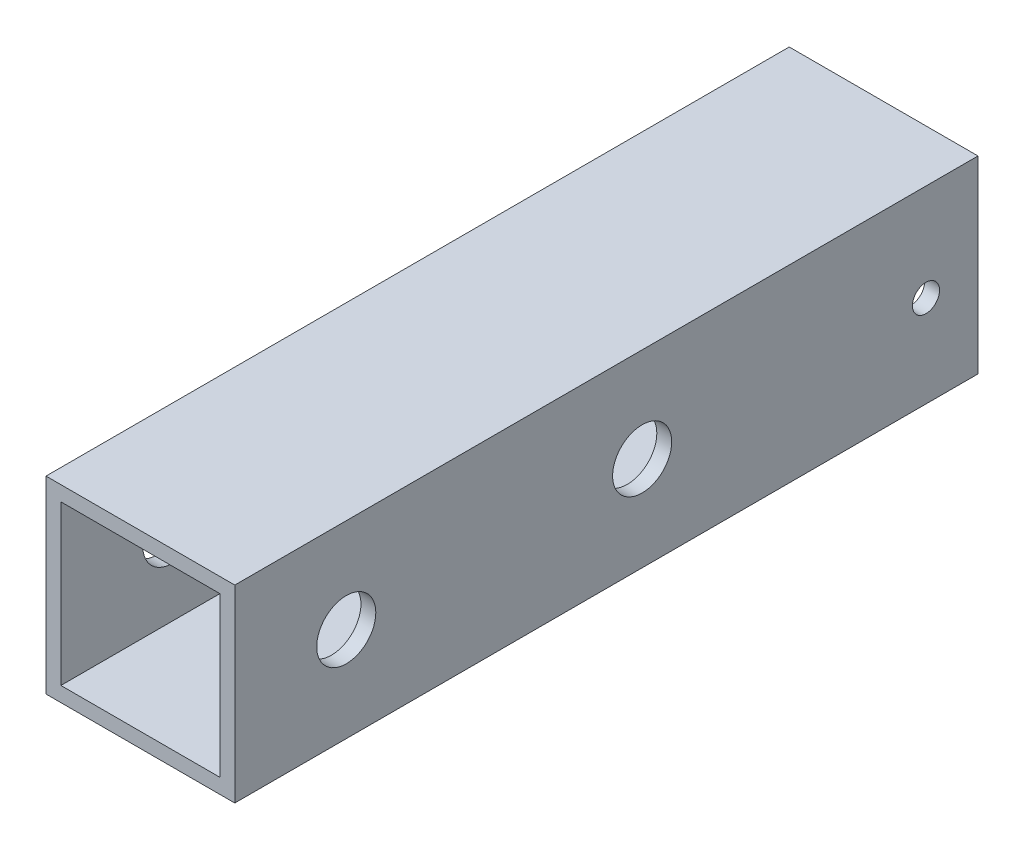
from build123d import *

# Parameters (mm, degrees)
SKETCH1_W           = 25.4
SKETCH1_H           = 25.4
SKETCH1_W_2         = 21.4
SKETCH1_H_2         = 21.4
BOSS_EXTRUDE1_DEPTH = 100
SKETCH2_R           = 3.975
CUT_EXTRUDE1_DEPTH  = 50
SKETCH3_R           = 1.55
CUT_EXTRUDE4_DEPTH  = 10
SKETCH4_R           = 1.778
CUT_EXTRUDE5_DEPTH  = 10
CUT_EXTRUDE6_REACH  = 108.256
SKETCH5_R           = 1.825


with BuildPart() as part:
    # Sketch1 → Boss-Extrude1 (new body)
    with BuildSketch(Plane.XY):
        with Locations((12.7, 12.7)):
            Rectangle(SKETCH1_W, SKETCH1_H)
        with Locations((12.7, 12.7)):
            Rectangle(SKETCH1_W_2, SKETCH1_H_2, mode=Mode.SUBTRACT)
    extrude(amount=BOSS_EXTRUDE1_DEPTH)

    # Sketch2 → Cut-Extrude1 (cut)
    with BuildSketch(Plane(origin=(25.4, 0, 0), x_dir=(0, 0, -1), z_dir=(1, 0, 0))):
        with Locations((-85, 12.7)):
            Circle(SKETCH2_R)
        with Locations((-45.19, 12.7)):
            Circle(SKETCH2_R)
    extrude(amount=-CUT_EXTRUDE1_DEPTH, mode=Mode.SUBTRACT)

    # Sketch3 → Cut-Extrude4 (cut)
    with BuildSketch(Plane.XZ):
        with BuildLine():
            Line((8.45, 10), (8.45, 70))
            ThreePointArc((8.45, 70), (6.9, 68.45), (5.35, 70))
            Line((5.35, 70), (5.35, 10))
            ThreePointArc((5.35, 10), (6.9, 11.55), (8.45, 10))
        make_face()
        with Locations((6.9, 10)):
            Circle(SKETCH3_R)
        with BuildLine():
            ThreePointArc((5.35, 70), (6.9, 68.45), (8.45, 70))
            ThreePointArc((8.45, 70), (6.9, 71.55), (5.35, 70))
        make_face()
    extrude(amount=-CUT_EXTRUDE4_DEPTH, mode=Mode.SUBTRACT)

    # Sketch4 → Cut-Extrude5 (cut)
    with BuildSketch(Plane.XZ):
        with Locations(Location((7.5, 2.765729771, 0), (0, 0, 270))):
            Circle(SKETCH4_R)
        with Locations(Location((17.5, 2.765729771, 0), (0, 0, 270))):
            Circle(SKETCH4_R)
    extrude(amount=-CUT_EXTRUDE5_DEPTH, mode=Mode.SUBTRACT)

    # Cut-Extrude6: up to this face of the body (flat: up to its plane)
    cut_extrude6_end = Plane(part.part.faces().sort_by_distance((25.4, 12.7, 49.385999137))[0])
    # Sketch5 → Cut-Extrude6 (cut, up to the picked face)
    with BuildSketch(Plane.ZY, mode=Mode.PRIVATE) as cut_extrude6_sk1:
        with Locations((7, 12.350192929)):
            Circle(SKETCH5_R)
    cut_extrude6_tool1 = split(extrude(cut_extrude6_sk1.sketch, amount=-CUT_EXTRUDE6_REACH, mode=Mode.PRIVATE), bisect_by=cut_extrude6_end, keep=Keep.BOTH, mode=Mode.PRIVATE)
    add(cut_extrude6_tool1.solids().sort_by(Axis((0, 12.350193, 7), (1, 0, 0)))[0], mode=Mode.SUBTRACT)


solid = part.part
